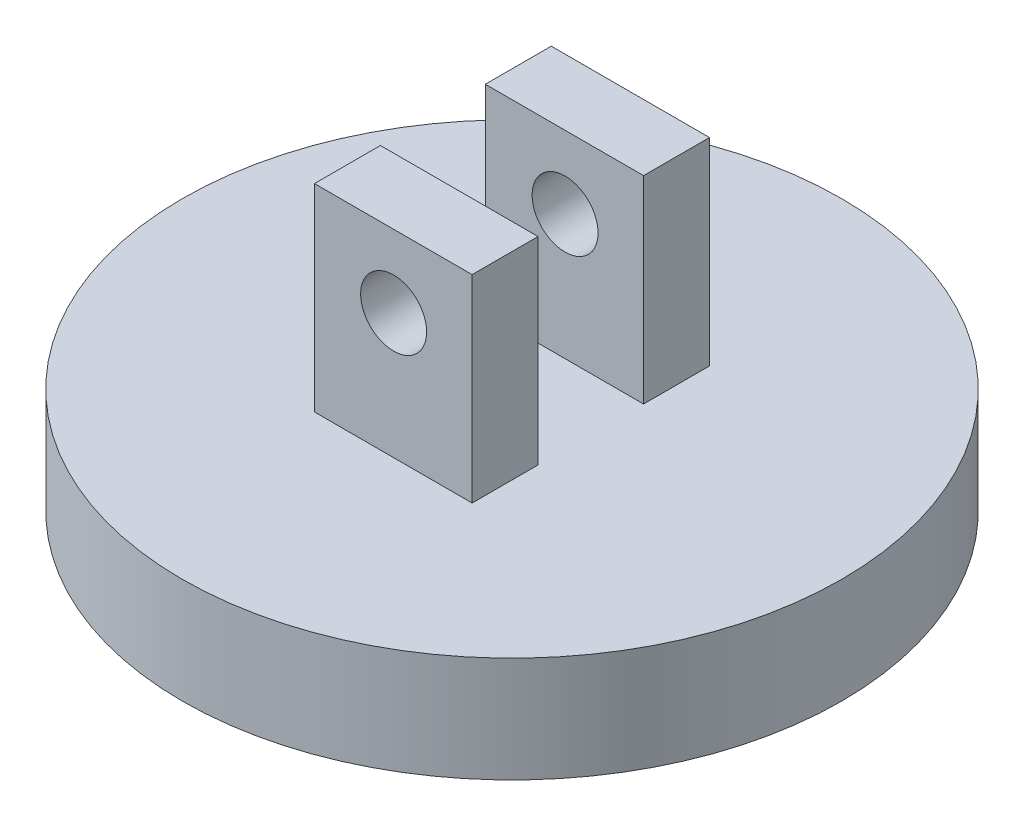
from build123d import *

# Parameters (mm, degrees)
SKETCH1_R           = 250
BOSS_EXTRUDE1_DEPTH = 80
SKETCH2_W           = 120
SKETCH2_H           = 50
SKETCH2_W_2         = 119.52714404
BOSS_EXTRUDE2_DEPTH = 150
SKETCH3_R           = 25
CUT_EXTRUDE1_DEPTH  = 481.624593628


with BuildPart() as part:
    # Sketch1 → Boss-Extrude1 (new body)
    with BuildSketch(Plane(origin=(0, 0, 0), x_dir=(1, 0, 0), z_dir=(0, 1, 0))):
        with Locations(Location((0, 0, 0), (0, 0, 270))):
            Circle(SKETCH1_R)
    extrude(amount=BOSS_EXTRUDE1_DEPTH)

    # Sketch2 → Boss-Extrude2 (add)
    with BuildSketch(Plane(origin=(0, 80, 0), x_dir=(1, 0, 0), z_dir=(0, 1, 0))):
        with Locations((-0.23642798, 65)):
            Rectangle(SKETCH2_W, SKETCH2_H)
        with Locations((0, -65)):
            Rectangle(SKETCH2_W_2, SKETCH2_H)
    extrude(amount=BOSS_EXTRUDE2_DEPTH)

    # Sketch3 → Cut-Extrude1 (cut, through all)
    with BuildSketch(Plane.XY.offset(90)):
        with Locations((0.23642798, 175)):
            Circle(SKETCH3_R)
    extrude(amount=-CUT_EXTRUDE1_DEPTH, mode=Mode.SUBTRACT)


solid = part.part
